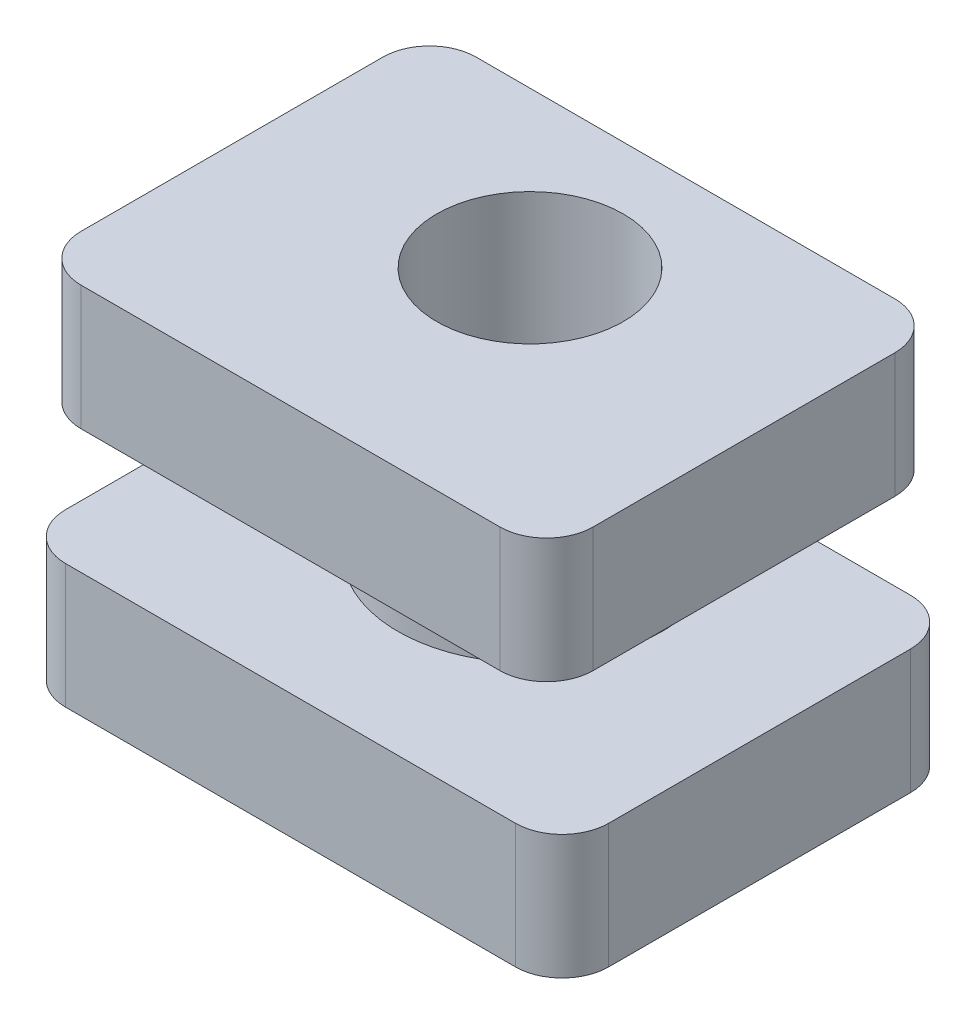
from build123d import *

# Parameters (mm, degrees)
BOSS_EXTRUDE1_DEPTH = 2.00000108
BOSS_EXTRUDE2_DEPTH = 2.00000108
BOSS_EXTRUDE3_DEPTH = 2.00000108
SKETCH4_R           = 1.499997
CUT_EXTRUDE1_DEPTH  = 9.070894964


with BuildPart() as part:
    # Sketch1 → Boss-Extrude1 (new body)
    with BuildSketch(Plane(origin=(0, 0, 0), x_dir=(1, 0, 0), z_dir=(0, 1, 0))):
        with BuildLine():
            Line((-3.61562396, -3.175), (3.61562396, -3.175))
            ThreePointArc((3.61562396, -3.175), (4.145954781, -2.955329781), (4.365625, -2.42499896))
            Line((4.365625, -2.42499896), (4.365625, 2.42499896))
            ThreePointArc((4.365625, 2.42499896), (4.145954781, 2.955329781), (3.61562396, 3.175))
            Line((3.61562396, 3.175), (-3.61562396, 3.175))
            ThreePointArc((-3.61562396, 3.175), (-4.145954781, 2.955329781), (-4.365625, 2.42499896))
            Line((-4.365625, 2.42499896), (-4.365625, -2.42499896))
            ThreePointArc((-4.365625, -2.42499896), (-4.145954781, -2.955329781), (-3.61562396, -3.175))
        make_face()
    extrude(amount=BOSS_EXTRUDE1_DEPTH)

    # Sketch2 → Boss-Extrude2 (add)
    with BuildSketch(Plane(origin=(0, 2.00000108, 0), x_dir=(1, 0, 0), z_dir=(0, 1, 0))):
        with BuildLine():
            Line((-1.50000081, 2.180197814), (-1.50000081, 2.17499946))
            Line((-1.50000081, 2.17499946), (1.50000081, 2.17499946))
            Line((1.50000081, 2.17499946), (1.50000081, 2.180197814))
            ThreePointArc((1.50000081, 2.180197814), (0, 2.79999948), (-1.50000081, 2.180197814))
        make_face()
        with BuildLine():
            Line((1.50000081, 2.17499946), (-1.50000081, 2.17499946))
            Line((-1.50000081, 2.17499946), (-1.50000081, 2.180197814))
            ThreePointArc((-1.50000081, 2.180197814), (-0.814899401, -1.287539785), (2.12499956, 0.67499992))
            ThreePointArc((2.12499956, 0.67499992), (1.962539705, 1.489899321), (1.50000081, 2.180197814))
            Line((1.50000081, 2.180197814), (1.50000081, 2.17499946))
        make_face()
        with BuildLine():
            Line((-1.50000081, 3.175), (-1.50000081, 2.180197814))
            ThreePointArc((-1.50000081, 2.180197814), (0, 2.79999948), (1.50000081, 2.180197814))
            Line((1.50000081, 2.180197814), (1.50000081, 3.175))
            Line((1.50000081, 3.175), (-1.50000081, 3.175))
        make_face()
    extrude(amount=BOSS_EXTRUDE2_DEPTH)

    # Sketch3 → Boss-Extrude3 (add)
    with BuildSketch(Plane(origin=(0, 4.00000216, 0), x_dir=(1, 0, 0), z_dir=(0, 1, 0))):
        with BuildLine():
            Line((-4.115624992, 2.42499896), (-4.115624992, -2.42499896))
            ThreePointArc((-4.115624992, -2.42499896), (-3.895954773, -2.955329781), (-3.365623952, -3.175))
            Line((-3.365623952, -3.175), (3.365623952, -3.175))
            ThreePointArc((3.365623952, -3.175), (3.895954773, -2.955329781), (4.115624992, -2.42499896))
            Line((4.115624992, -2.42499896), (4.115624992, 2.42499896))
            ThreePointArc((4.115624992, 2.42499896), (3.895954773, 2.955329781), (3.365623952, 3.175))
            Line((3.365623952, 3.175), (-3.365623952, 3.175))
            ThreePointArc((-3.365623952, 3.175), (-3.895954773, 2.955329781), (-4.115624992, 2.42499896))
        make_face()
    extrude(amount=BOSS_EXTRUDE3_DEPTH)

    # Sketch4 → Cut-Extrude1 (cut, through all)
    with BuildSketch(Plane.XZ):
        with Locations(Location((0, -0.67499992, 0), (0, 0, 270))):
            Circle(SKETCH4_R)
    extrude(amount=-CUT_EXTRUDE1_DEPTH, mode=Mode.SUBTRACT)


solid = part.part
